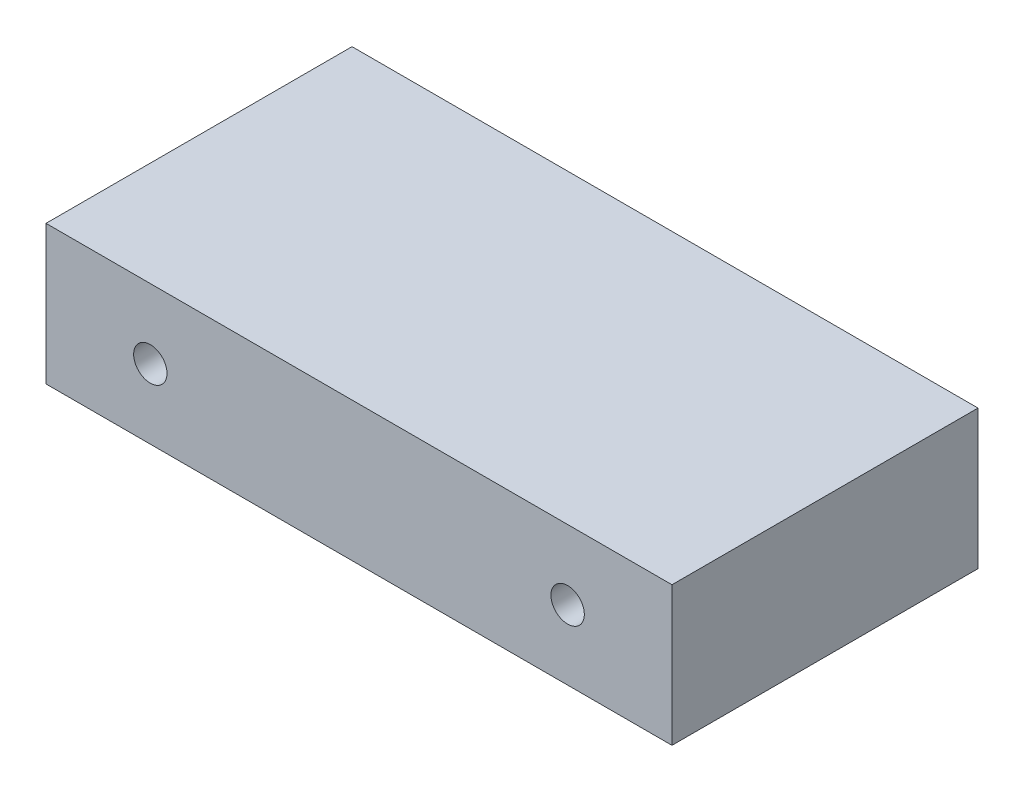
from build123d import *

# Parameters (mm, degrees)
ESQUISSE1_W             = 45
ESQUISSE1_H             = 22
BOSS_EXTRU_1_DEPTH      = 5
ESQUISSE2_R             = 1.2
ENL_V_MAT_EXTRU_1_DEPTH = 32.862987933


with BuildPart() as part:
    # Esquisse1 → Boss.-Extru.1 (new, symmetric)
    with BuildSketch(Plane(origin=(0, 0, 0), x_dir=(1, 0, 0), z_dir=(0, 1, 0))):
        with Locations((0, -11)):
            Rectangle(ESQUISSE1_W, ESQUISSE1_H)
    extrude(amount=BOSS_EXTRU_1_DEPTH, both=True)

    # Esquisse2 → Enlèv. mat.-Extru.1 (cut, through all)
    with BuildSketch(Plane.XY.offset(22)):
        with Locations((-15, 0)):
            Circle(ESQUISSE2_R)
        with Locations((15, 0)):
            Circle(ESQUISSE2_R)
    extrude(amount=-ENL_V_MAT_EXTRU_1_DEPTH, mode=Mode.SUBTRACT)


solid = part.part
